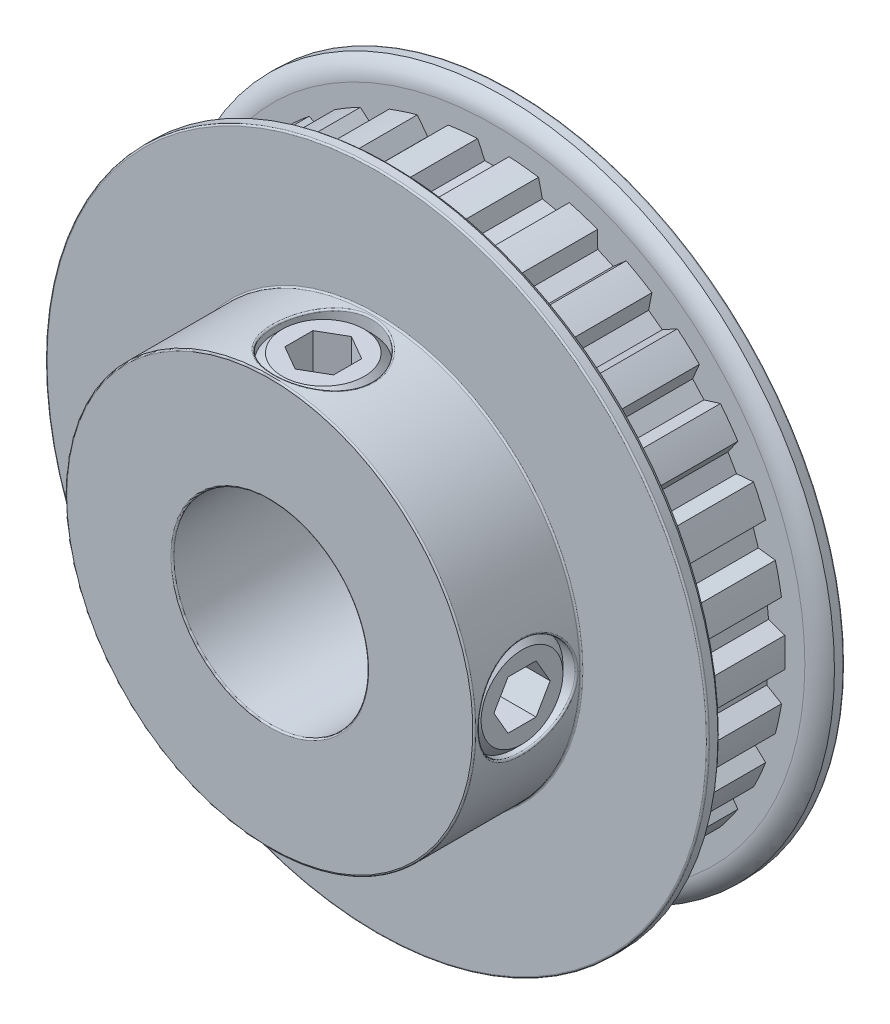
from build123d import *

# Parameters (mm, degrees)
CUT_EXTRUDE1_START = -0.4191
CUT_EXTRUDE1_DEPTH = 7.874
CIRPATTERN1_COUNT  = 30
SKETCH4_R          = 3.96875
CUT_EXTRUDE2_DEPTH = 40.433880385
CUT_EXTRUDE3_DEPTH = 2.9765625
CIRPATTERN2_COUNT  = 2
CIRPATTERN2_ANGLE  = 90
FILLET1_R          = 0.127


with BuildPart() as part:
    # Sketch2 → Revolve1 (revolve)
    with BuildSketch(Plane(origin=(0, 0, 0), x_dir=(0, 0, -1), z_dir=(1, 0, 0)), mode=Mode.PRIVATE) as revolve1_sk:
        with BuildLine():
            Line((-9.9187, 7.9375), (9.9187, 7.9375))
            Line((9.9187, 7.9375), (9.9187, 26.9875))
            Line((9.9187, 26.9875), (9.1059, 26.9875))
            ThreePointArc((9.1059, 26.9875), (8.50792439, 26.28373102), (8.2931, 25.385557267))
            Line((8.2931, 25.385557267), (8.2931, 23.783614534))
            Line((8.2931, 23.783614534), (0.4191, 23.783614534))
            Line((0.4191, 23.783614534), (0.4191, 25.385557267))
            ThreePointArc((0.4191, 25.385557267), (0.20427561, 26.28373102), (-0.3937, 26.9875))
            Line((-0.3937, 26.9875), (-1.2065, 26.9875))
            Line((-1.2065, 26.9875), (-1.2065, 16.6751))
            Line((-1.2065, 16.6751), (-9.9187, 16.6751))
            Line((-9.9187, 16.6751), (-9.9187, 7.9375))
        make_face()
    revolve(revolve1_sk.sketch.rotate(Axis((0, 0, 9.9187), (0, 0, -1)), 90), axis=Axis((0, 0, 9.9187), (0, 0, -1)))

    # Sketch3 → Cut-Extrude1 (cut)
    with BuildSketch(Plane.XY.offset(CUT_EXTRUDE1_START)):
        with BuildLine():
            Line((-0.690489274, 22.479), (0.690489274, 22.479))
            Line((0.690489274, 22.479), (1.2827, 23.749))
            ThreePointArc((1.2827, 23.749), (0, 23.783614534), (-1.2827, 23.749))
            Line((-1.2827, 23.749), (-0.690489274, 22.479))
        make_face()
    cut_extrude1 = extrude(amount=-CUT_EXTRUDE1_DEPTH, mode=Mode.SUBTRACT)

    # CirPattern1: Cut-Extrude1 ×30 about axis
    cirpattern1_axis = Axis((0, 0, 0), (0, 0, 1))
    for i in range(1, CIRPATTERN1_COUNT):
        add(cut_extrude1.rotate(cirpattern1_axis, i * 360 / CIRPATTERN1_COUNT), mode=Mode.SUBTRACT)

    # Sketch4 → Cut-Extrude2 (cut, through all)
    with BuildSketch(Plane(origin=(0, 0, 0), x_dir=(1, 0, 0), z_dir=(0, 1, 0))):
        with Locations(Location((0, -5.5626, 0), (0, 0, 90))):
            Circle(SKETCH4_R)
    cut_extrude2 = extrude(amount=CUT_EXTRUDE2_DEPTH, mode=Mode.SUBTRACT)

    # Sketch5 → Revolve2 (revolve)
    with BuildSketch(Plane.XY.offset(5.5626), mode=Mode.PRIVATE) as revolve2_sk:
        Polygon((0, 16.195924903), (0, 7.9375), (-3.33375, 7.9375), (-3.96875, 8.5725), (-3.96875, 15.560924903), (-3.33375, 16.195924903), align=None)
    revolve2 = revolve(revolve2_sk.sketch.rotate(Axis((0, 0, 5.5626), (0, 1, 0)), 270), axis=Axis((0, 0, 5.5626), (0, 1, 0)))

    # Sketch6 → Cut-Extrude3 (cut)
    with BuildSketch(Plane(origin=(0, 16.195924903, 0), x_dir=(-1, 0, 0), z_dir=(0, -1, 0))):
        Polygon((0, -3.271241119), (-1.984375, -4.41692056), (-1.984375, -6.70827944), (0, -7.853958881), (1.984375, -6.70827944), (1.984375, -4.41692056), align=None)
    cut_extrude3 = extrude(amount=CUT_EXTRUDE3_DEPTH, mode=Mode.SUBTRACT)

    # CirPattern2: Cut-Extrude2, Revolve2, Cut-Extrude3 ×2 about axis
    cirpattern2_axis = Axis((0, 0, 0), (0, 0, -1))
    add([cut_extrude2.rotate(cirpattern2_axis, i * CIRPATTERN2_ANGLE / (CIRPATTERN2_COUNT - 1)) for i in range(1, CIRPATTERN2_COUNT)], mode=Mode.SUBTRACT)
    add([revolve2.rotate(cirpattern2_axis, i * CIRPATTERN2_ANGLE / (CIRPATTERN2_COUNT - 1)) for i in range(1, CIRPATTERN2_COUNT)])
    add([cut_extrude3.rotate(cirpattern2_axis, i * CIRPATTERN2_ANGLE / (CIRPATTERN2_COUNT - 1)) for i in range(1, CIRPATTERN2_COUNT)], mode=Mode.SUBTRACT)

    # Fillet1
    fillet1_edges = [part.edges().sort_by_distance(p)[0] for p in [
        (-26.9875, 0, -9.9187),
        (-7.9375, 0, -9.9187),
        (-7.9375, 0, 9.9187),
        (0, 16.675099999, 9.531350002),
        (16.195924903, -3.96875, 5.5626),
        (-16.6751, 0, 9.9187),
        (-16.6751, 0, 1.2065),
        (-26.9875, 0, 1.2065),
    ]]
    fillet(fillet1_edges, radius=FILLET1_R)


solid = part.part
